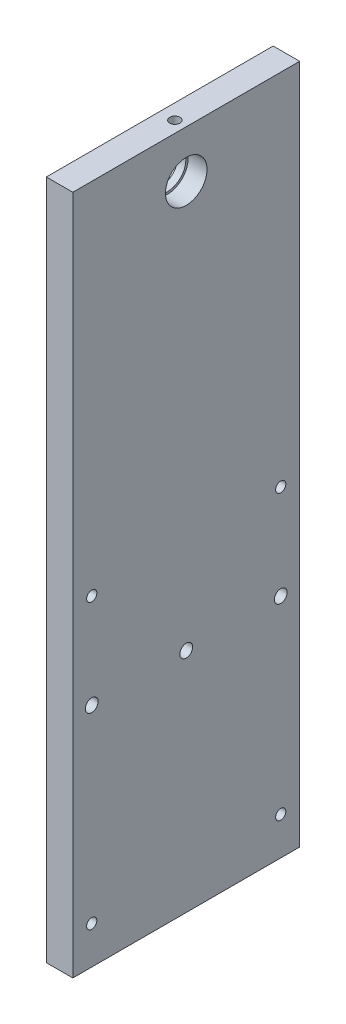
from build123d import *

# Parameters (mm, degrees)
SKETCH_1_W                   = 60
SKETCH_1_H                   = 180
EXTRUDE_1_DEPTH              = 7
SKETCH_2_R                   = 5.5
CUT_EXTRUDE_1_DEPTH          = 5
SKETCH_3_R                   = 4.9
CUT_EXTRUDE_2_DEPTH          = 96
HOLE_WIZARD_M3_1_D           = 3.4
HOLE_WIZARD_M3_1_DEPTH       = 7.5
HOLE_WIZARD_M3_1_CSINK_D     = 6.3
HOLE_WIZARD_M3_1_CSINK_ANGLE = 90
HOLE_WIZARD_M3_1_TIP         = 1.021463052
F_1_0MM_3_REACH              = 184.617
F_1_0MM_3_BORE_R             = 1.35
F_1_0MM_2_D                  = 2.7
F_1_0MM_2_DEPTH              = 7.5
F_1_0MM_2_TIP                = 0.811161836
F_1_0MM_1_D                  = 2.7


with BuildPart() as part:
    # 草圖1 → 填料-伸長1 (new body)
    with BuildSketch(Plane(origin=(0, 0, 0), x_dir=(0, 0, -1), z_dir=(1, 0, 0))):
        Rectangle(SKETCH_1_W, SKETCH_1_H)
    extrude(amount=EXTRUDE_1_DEPTH)

    # 草圖2 → 除料-伸長1 (cut)
    with BuildSketch(Plane(origin=(7, 0, 0), x_dir=(0, 0, -1), z_dir=(1, 0, 0))):
        with Locations((0, 77.5)):
            Circle(SKETCH_2_R)
    extrude(amount=-CUT_EXTRUDE_1_DEPTH, mode=Mode.SUBTRACT)

    # 草圖3 → 除料-伸長2 (cut, through all)
    with BuildSketch(Plane(origin=(2, 0, 0), x_dir=(0, 0, -1), z_dir=(1, 0, 0))):
        with Locations((0, 77.5)):
            Circle(SKETCH_3_R)
    extrude(amount=-CUT_EXTRUDE_2_DEPTH, mode=Mode.SUBTRACT)

    # M3 錐坑平頭螺釘的錐孔1
    with Locations(Plane.ZY):
        with Locations((-25, -30), (0, -30), (25, -30)):
            CounterSinkHole(HOLE_WIZARD_M3_1_D / 2, HOLE_WIZARD_M3_1_CSINK_D / 2, depth=HOLE_WIZARD_M3_1_DEPTH, counter_sink_angle=HOLE_WIZARD_M3_1_CSINK_ANGLE)
            with Locations((0, 0, -(HOLE_WIZARD_M3_1_DEPTH + HOLE_WIZARD_M3_1_TIP / 2))):  # 118° drill point
                Cone(0, HOLE_WIZARD_M3_1_D / 2, HOLE_WIZARD_M3_1_TIP, mode=Mode.SUBTRACT)

    # Ø1.0mm 定位孔3 bore → Ø1.0mm 定位孔3 (cut, up to next)
    with BuildSketch(Plane(origin=(0, 90, 0), x_dir=(1, 0, 0), z_dir=(0, 1, 0)), mode=Mode.PRIVATE) as f_1_0mm_3_sk1:
        with Locations((4, 0)):
            Circle(F_1_0MM_3_BORE_R)
    f_1_0mm_3_tool1 = extrude(f_1_0mm_3_sk1.sketch, amount=-F_1_0MM_3_REACH, mode=Mode.PRIVATE) & part.part
    add(f_1_0mm_3_tool1.solids().sort_by_distance((4, 90, 0))[0], mode=Mode.SUBTRACT)

    # Ø1.0mm 定位孔2
    with Locations(Plane(origin=(0, -90, 0), x_dir=(-1, 0, 0), z_dir=(0, -1, 0))):
        with Locations((-3.5, 25), (-3.5, 0), (-3.5, -25)):
            Hole(F_1_0MM_2_D / 2, depth=F_1_0MM_2_DEPTH)
            with Locations((0, 0, -(F_1_0MM_2_DEPTH + F_1_0MM_2_TIP / 2))):  # 118° drill point
                Cone(0, F_1_0MM_2_D / 2, F_1_0MM_2_TIP, mode=Mode.SUBTRACT)

    # Ø1.0mm 定位孔1 (through all)
    with Locations(Plane.ZY):
        with Locations((25, -5), (25, -80), (-25, -80), (-25, -5)):
            Hole(F_1_0MM_1_D / 2)


solid = part.part
